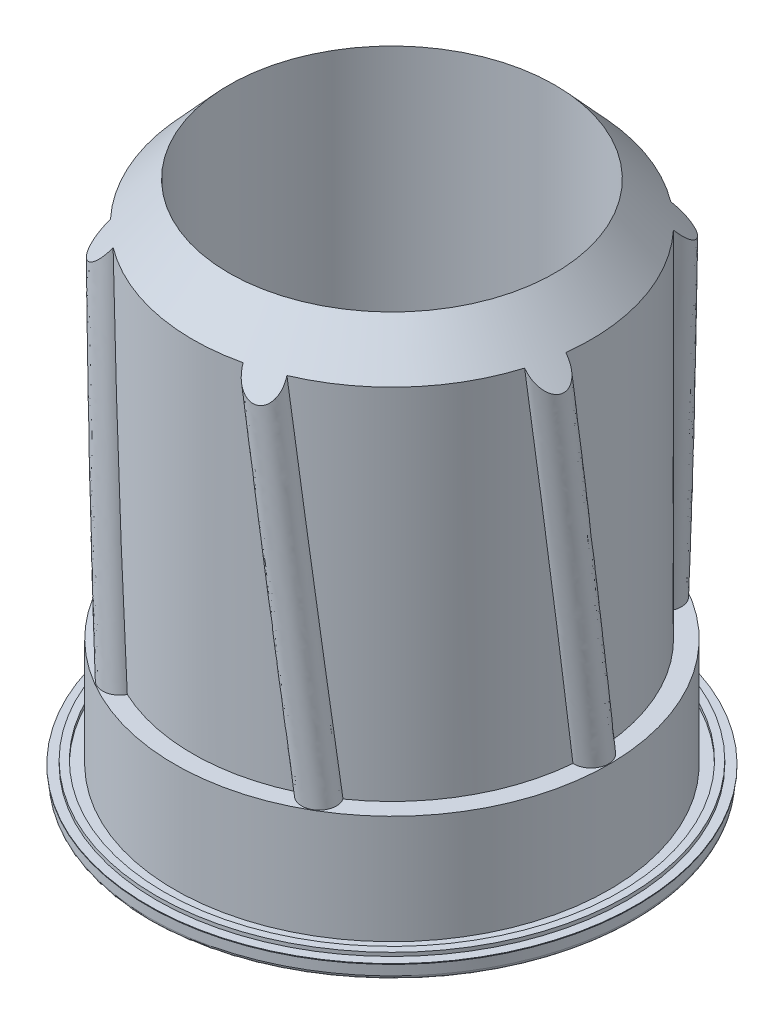
from build123d import *

# Parameters (mm, degrees)
BARRER1_PITCH       = 150
BARRER1_HEIGHT      = 5
BARRER1_RADIUS      = 2.75
BARRER1_START_ANGLE = 90
MATRIZC1_COUNT      = 6
REDONDEO1_R         = 0.05


with BuildPart() as part:
    # Croquis1 → Revolución1 (revolve)
    with BuildSketch(Plane.XY, mode=Mode.PRIVATE) as revoluci_n1_sk:
        with BuildLine():
            Line((2.25, 0), (0, 0))
            Line((0, 0), (0, -0.6572636))
            ThreePointArc((0, -0.6572636), (1.690531721, -0.542420139), (3.35, -0.2))
            Line((3.35, -0.2), (3.35, -0.01))
            Line((3.35, -0.01), (3.37, -0.01))
            Line((3.37, -0.01), (3.37, 0))
            Line((3.37, 0), (3.25, 0))
            Line((3.25, 0), (3.25, 0.05))
            Line((3.25, 0.05), (3.15, 0.05))
            Line((3.15, 0.05), (3.15, 0))
            Line((3.15, 0), (3, 0))
            Line((3, 0), (3, 1.5))
            Line((3, 1.5), (2.75, 1.5))
            Line((2.75, 1.5), (2.75, 7))
            Line((2.75, 7), (2.25, 7))
            Line((2.25, 7), (2.25, 0))
        make_face()
    revolve(revoluci_n1_sk.sketch.rotate(Axis((0, 0, 0), (0, 1, 0)), 90), axis=Axis((0, 0, 0), (0, 1, 0)))

    # Barrer1: sweep along a helix
    with BuildLine() as barrer1_path:
        add(Helix(BARRER1_PITCH, BARRER1_HEIGHT, BARRER1_RADIUS, center=(0, 1.5, 0), direction=(0, 1, 0), lefthand=True, mode=Mode.PRIVATE).rotate(Axis((0, 1.5, 0), (0, 1, 0)), BARRER1_START_ANGLE))
    # Croquis2 → Barrer1 (sweep)
    with BuildSketch(Plane(origin=(0, 1.5, 0), x_dir=(1, 0, 0), z_dir=(0, 1, 0))):
        with BuildLine():
            ThreePointArc((2.73953542, -0.239678293), (2.989906631, 0), (2.73953542, 0.239678293))
            ThreePointArc((2.73953542, 0.239678293), (2.75, 0), (2.73953542, -0.239678293))
        make_face()
    barrer1 = sweep(path=barrer1_path.line, is_frenet=True)

    # MatrizC1: Barrer1 ×6 about axis
    matrizc1_axis = Axis((0, 7, 0), (0, -1, 0))
    for i in range(1, MATRIZC1_COUNT):
        add(barrer1.rotate(matrizc1_axis, i * 360 / MATRIZC1_COUNT))

    # Redondeo1
    redondeo1_edges = [part.edges().sort_by_distance(p)[0] for p in [
        (0, -0.2, 3.35),
    ]]
    fillet(redondeo1_edges, radius=REDONDEO1_R)

    # Croquis7 → Cortar-Revolución1 (revolve, cut)
    with BuildSketch(Plane.XY, mode=Mode.PRIVATE) as cortar_revoluci_n1_sk:
        Polygon((2.25, 7), (3.437132412, 5.704472307), (3.437132412, 7), align=None)
    revolve(cortar_revoluci_n1_sk.sketch.rotate(Axis((0, 0, 0), (0, 1, 0)), 180), axis=Axis((0, 0, 0), (0, 1, 0)), mode=Mode.SUBTRACT)


solid = part.part
